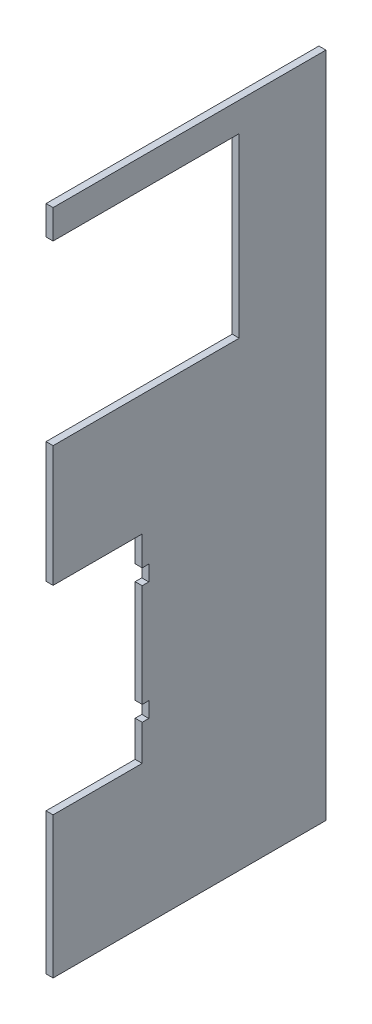
from build123d import *

# Parameters (mm, degrees)
SKETCH_1_W          = 95
SKETCH_1_H          = 38.85
EXTRUDE_1_DEPTH     = 0.5
SKETCH_2_W          = 38.85
SKETCH_2_H          = 95
EXTRUDE_2_DEPTH     = 0.5
SKETCH_3_W          = 31.441881793
SKETCH_3_H          = 25.227375523
CUT_EXTRUDE_1_DEPTH = 110.347085009


with BuildPart() as part:
    # Эскиз1 → Бобышка-Вытянуть1 (new body)
    with BuildSketch(Plane(origin=(0.5, 0, 0), x_dir=(0, -1, 0), z_dir=(-1, 0, 0))):
        with Locations((-53.35, 22.825)):
            Rectangle(SKETCH_1_W, SKETCH_1_H)
    extrude(amount=-EXTRUDE_1_DEPTH)

    # Эскиз2 → Бобышка-Вытянуть2 (add)
    with BuildSketch(Plane.ZY.offset(-0.5)):
        with Locations((22.825, 53.35)):
            Rectangle(SKETCH_2_W, SKETCH_2_H)
    extrude(amount=EXTRUDE_2_DEPTH)

    # Эскиз3 → Вырез-Вытянуть1 (cut, through all)
    with BuildSketch(Plane.ZY):
        Polygon((47.187175015, 54.261978396), (29.562288031, 54.261978396), (29.562288031, 50.078726521), (28.618889228, 50.078726521), (28.618889228, 47.878726521), (29.562288031, 47.878726521), (29.562288031, 33.238726521), (28.618889228, 33.238726521), (28.618889228, 31.038726521), (29.562288031, 31.038726521), (29.562288031, 25.969159943), (47.187175015, 25.969159943), align=None)
        with Locations((31.466234119, 84.106984297)):
            Rectangle(SKETCH_3_W, SKETCH_3_H)
    extrude(amount=-CUT_EXTRUDE_1_DEPTH, mode=Mode.SUBTRACT)


solid = part.part
